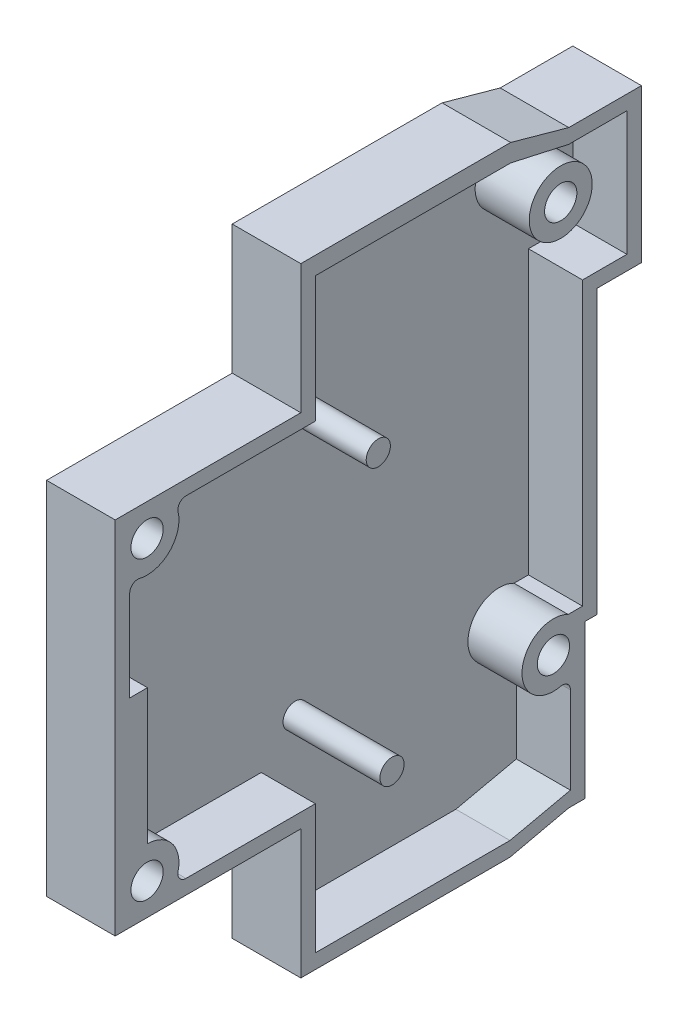
from build123d import *

# Parameters (mm, degrees)
SKETCH_1_R        = 2
EXTRUDE_2_DEPTH   = 8.5
SKETCH_1_R_2      = 3.9
EXTRUDE_2_2_DEPTH = 8.5
SKETCH_1_6_R      = 1.5
SKETCH_1_6_R_2    = 3.9
EXTRUDE_3_DEPTH   = 1.8
SKETCH_1_7_R      = 1.5
EXTRUDE_4_DEPTH   = 13.8


with BuildPart() as part:
    # Эскиз1 → Бобышка-Вытянуть2 (new body)
    with BuildSketch(Plane(origin=(0, 0, 0), x_dir=(0, 0, -1), z_dir=(1, 0, 0))):
        Polygon((-6.85, 38.325), (-6.85, 22.325), (-29.85, 22.325), (-29.85, -22.325), (-6.85, -22.325), (-6.85, -38.325), (19.061824645, -38.325), (26.35, -36.675), (28.35, -36.675), (28.35, -17.675), (29.85, -17.675), (29.85, 17.325), (35.35, 17.325), (35.35, 36.325), (26.35, 36.325), (19.15, 38.325), align=None)
        with Locations((-25.9, -18.375)):
            Circle(SKETCH_1_R, mode=Mode.SUBTRACT)
        with BuildLine():
            Line((-5.05, -36.525), (-5.05, -20.525))
            Line((-5.05, -20.525), (-21.085438753, -20.525))
            ThreePointArc((-21.085438753, -20.525), (-21.87039838, -20.144546918), (-22.058077389, -19.292676768))
            ThreePointArc((-22.058077389, -19.292676768), (-22.783982594, -15.947463074), (-25.85, -14.425316468))
            Line((-25.85, -14.425316468), (-25.85, 2.325))
            Line((-25.85, 2.325), (-28.05, 2.325))
            Line((-28.05, 2.325), (-28.05, 13.560438753))
            ThreePointArc((-28.05, 13.560438753), (-27.669546918, 14.34539838), (-26.817676768, 14.533077389))
            ThreePointArc((-26.817676768, 14.533077389), (-23.106928214, 15.581928214), (-22.058077389, 19.292676768))
            ThreePointArc((-22.058077389, 19.292676768), (-21.87039838, 20.144546918), (-21.085438753, 20.525))
            Line((-21.085438753, 20.525), (-5.05, 20.525))
            Line((-5.05, 20.525), (-5.05, 36.125))
            Line((-5.05, 36.125), (19.15, 36.125))
            Line((19.15, 36.125), (26.35, 34.525))
            Line((26.35, 34.525), (33.55, 34.525))
            Line((33.55, 34.525), (33.55, 19.125))
            Line((33.55, 19.125), (28.05, 19.125))
            Line((28.05, 19.125), (28.05, -15.875))
            Line((28.05, -15.875), (26.268653348, -15.875))
            ThreePointArc((26.268653348, -15.875), (20.582582899, -18.821924489), (25.325510204, -23.125458115))
            ThreePointArc((25.325510204, -23.125458115), (26.172699849, -23.317473758), (26.55, -24.099934555))
            Line((26.55, -24.099934555), (26.55, -34.875))
            Line((26.55, -34.875), (19.061824645, -36.525))
            Line((19.061824645, -36.525), (-5.05, -36.525))
        make_face(mode=Mode.SUBTRACT)
        with Locations((24.45, -19.325)):
            Circle(SKETCH_1_R, mode=Mode.SUBTRACT)
        with Locations((-25.9, 18.375)):
            Circle(SKETCH_1_R, mode=Mode.SUBTRACT)
    extrude(amount=EXTRUDE_2_DEPTH)



with BuildPart() as body_2:
    # Эскиз1 → Extrude 2 2 (new body)
    with BuildSketch(Plane(origin=(0, 0, 0), x_dir=(0, 0, -1), z_dir=(1, 0, 0))):
        with Locations((25.35, 28.825)):
            Circle(SKETCH_1_R_2)
        with Locations((25.35, 28.825)):
            Circle(SKETCH_1_R, mode=Mode.SUBTRACT)
    extrude(amount=EXTRUDE_2_2_DEPTH)


with BuildPart() as part_1:
    add(part.part)

    add(body_2.part)  # Бобышка-Вытянуть3 merges body 2
    # Эскиз1<6> → Бобышка-Вытянуть3 (add)
    with BuildSketch(Plane(origin=(0, 0, 0), x_dir=(0, 0, -1), z_dir=(1, 0, 0))):
        with BuildLine():
            Line((-21.085438753, -20.525), (-5.05, -20.525))
            Line((-5.05, -20.525), (-5.05, -36.525))
            Line((-5.05, -36.525), (19.061824645, -36.525))
            Line((19.061824645, -36.525), (26.55, -34.875))
            Line((26.55, -34.875), (26.55, -24.099934555))
            ThreePointArc((26.55, -24.099934555), (26.172699849, -23.317473758), (25.325510204, -23.125458115))
            ThreePointArc((25.325510204, -23.125458115), (20.582582899, -18.821924489), (26.268653348, -15.875))
            Line((26.268653348, -15.875), (26.55, -15.875))
            Line((26.55, -15.875), (28.05, -15.875))
            Line((28.05, -15.875), (28.05, 19.125))
            Line((28.05, 19.125), (33.55, 19.125))
            Line((33.55, 19.125), (33.55, 34.525))
            Line((33.55, 34.525), (26.35, 34.525))
            Line((26.35, 34.525), (19.15, 36.125))
            Line((19.15, 36.125), (-5.05, 36.125))
            Line((-5.05, 36.125), (-5.05, 20.525))
            Line((-5.05, 20.525), (-21.085438753, 20.525))
            ThreePointArc((-21.085438753, 20.525), (-21.87039838, 20.144546918), (-22.058077389, 19.292676768))
            ThreePointArc((-22.058077389, 19.292676768), (-23.106928214, 15.581928214), (-26.817676768, 14.533077389))
            ThreePointArc((-26.817676768, 14.533077389), (-27.669546918, 14.34539838), (-28.05, 13.560438753))
            Line((-28.05, 13.560438753), (-28.05, 2.325))
            Line((-28.05, 2.325), (-25.85, 2.325))
            Line((-25.85, 2.325), (-25.85, -14.425316468))
            ThreePointArc((-25.85, -14.425316468), (-22.783982594, -15.947463074), (-22.058077389, -19.292676768))
            ThreePointArc((-22.058077389, -19.292676768), (-21.87039838, -20.144546918), (-21.085438753, -20.525))
        make_face()
        with Locations((-0.85, -16.475)):
            Circle(SKETCH_1_6_R, mode=Mode.SUBTRACT)
        with Locations((-2.55, 18.525)):
            Circle(SKETCH_1_6_R, mode=Mode.SUBTRACT)
        with Locations((25.35, 28.825)):
            Circle(SKETCH_1_6_R_2, mode=Mode.SUBTRACT)
    extrude(amount=EXTRUDE_3_DEPTH)

    # Эскиз1<7> → Бобышка-Вытянуть4 (add)
    with BuildSketch(Plane(origin=(0, 0, 0), x_dir=(0, 0, -1), z_dir=(1, 0, 0))):
        with Locations((-0.85, -16.475)):
            Circle(SKETCH_1_7_R)
        with Locations((-2.55, 18.525)):
            Circle(SKETCH_1_7_R)
    extrude(amount=EXTRUDE_4_DEPTH)


solid = part_1.part
